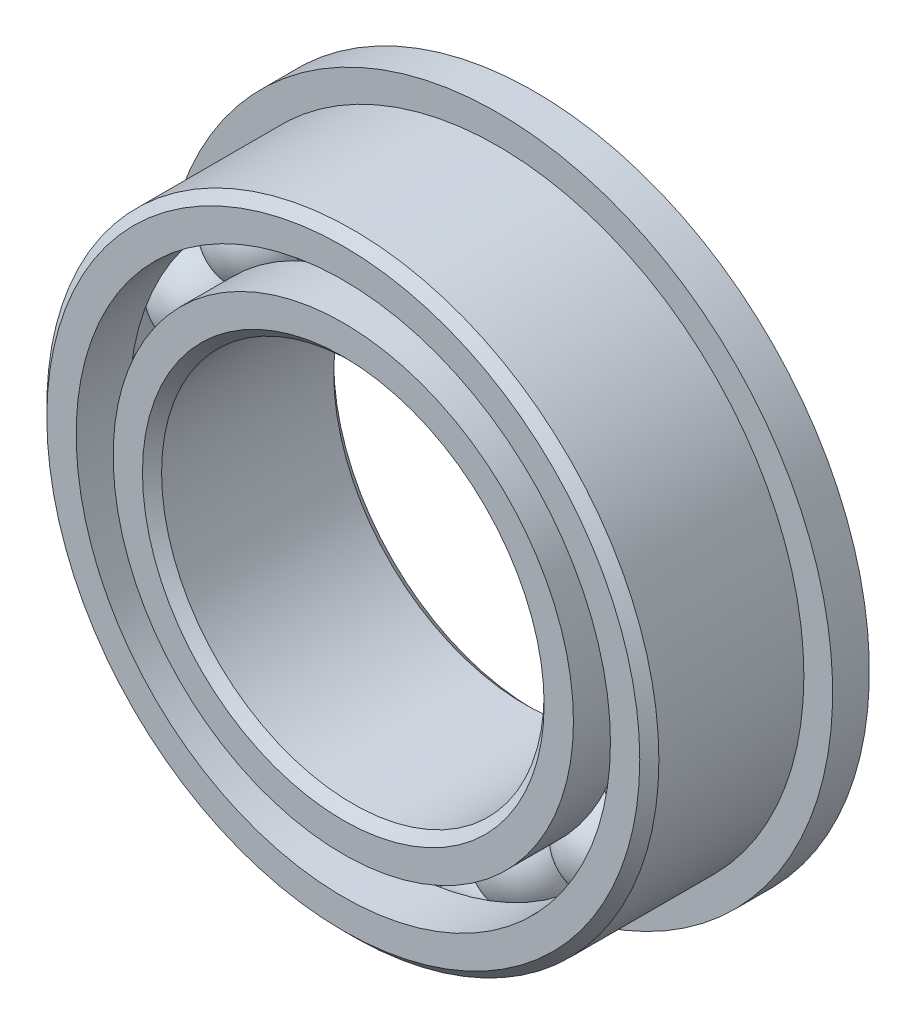
from build123d import *

# Parameters (mm, degrees)
CIRPATTERN1_COUNT = 16
SKETCH6_W         = 0.762
SKETCH6_H         = 1.403733791


with BuildPart() as part:
    # Sketch1 → Revolve1 (revolve)
    with BuildSketch(Plane(origin=(0, 0, 0), x_dir=(0, 0, -1), z_dir=(1, 0, 0))):
        with BuildLine():
            Line((1.7859375, 6.35), (-1.7859375, 6.35))
            Line((-1.7859375, 6.35), (-1.984375, 6.1515625))
            Line((-1.984375, 6.1515625), (-1.984375, 5.543166209))
            Line((-1.984375, 5.543166209), (-0.881944444, 5.543166209))
            ThreePointArc((-0.881944444, 5.543166209), (0, 6.121207467), (0.881944444, 5.543166209))
            Line((0.881944444, 5.543166209), (1.984375, 5.543166209))
            Line((1.984375, 5.543166209), (1.984375, 6.1515625))
            Line((1.984375, 6.1515625), (1.7859375, 6.35))
        make_face()
    revolve(axis=Axis((0, 0, 1.984375), (0, 0, -1)))

    # Sketch6 → Revolve6 (revolve)
    with BuildSketch(Plane(origin=(0, 0, 0), x_dir=(0, 0, -1), z_dir=(1, 0, 0))):
        with Locations((1.603375, 6.245033105)):
            Rectangle(SKETCH6_W, SKETCH6_H)
    revolve(axis=Axis((0, 0, -1.984375), (0, 0, 1)))


with BuildPart() as body_2:
    # Sketch3 → Revolve3 (revolve)
    with BuildSketch(Plane(origin=(0, 0, 0), x_dir=(0, 0, -1), z_dir=(1, 0, 0))):
        with BuildLine():
            Line((-1.984375, 4.775583791), (-0.881944444, 4.775583791))
            ThreePointArc((-0.881944444, 4.775583791), (0, 4.197542533), (0.881944444, 4.775583791))
            Line((0.881944444, 4.775583791), (1.984375, 4.775583791))
            Line((1.984375, 4.775583791), (1.984375, 4.1671875))
            Line((1.984375, 4.1671875), (1.7859375, 3.96875))
            Line((1.7859375, 3.96875), (-1.7859375, 3.96875))
            Line((-1.7859375, 3.96875), (-1.984375, 4.1671875))
            Line((-1.984375, 4.1671875), (-1.984375, 4.775583791))
        make_face()
    revolve(axis=Axis((0, 0, 1.984375), (0, 0, -1)))


with BuildPart() as body_3:
    # Sketch4 → Revolve4 (revolve)
    with BuildSketch(Plane(origin=(0, 0, 0), x_dir=(0, 0, -1), z_dir=(1, 0, 0))):
        with BuildLine():
            Line((-0.961832467, 5.159375), (0.961832467, 5.159375))
            ThreePointArc((0.961832467, 5.159375), (0, 6.121207467), (-0.961832467, 5.159375))
        make_face()
    revolve(axis=Axis((0, 5.159375, 0.961832467), (0, 0, -1)))


with BuildPart() as cirpattern1_1:
    # CirPattern1: pattern copy
    add(body_3.part.rotate(Axis((0, 0, -1.984375), (0, 0, 1)), 1 * 360 / CIRPATTERN1_COUNT))


with BuildPart() as cirpattern1_2:
    # CirPattern1: pattern copy
    add(body_3.part.rotate(Axis((0, 0, -1.984375), (0, 0, 1)), 2 * 360 / CIRPATTERN1_COUNT))


with BuildPart() as cirpattern1_3:
    # CirPattern1: pattern copy
    add(body_3.part.rotate(Axis((0, 0, -1.984375), (0, 0, 1)), 3 * 360 / CIRPATTERN1_COUNT))


with BuildPart() as cirpattern1_4:
    # CirPattern1: pattern copy
    add(body_3.part.rotate(Axis((0, 0, -1.984375), (0, 0, 1)), 4 * 360 / CIRPATTERN1_COUNT))


with BuildPart() as cirpattern1_5:
    # CirPattern1: pattern copy
    add(body_3.part.rotate(Axis((0, 0, -1.984375), (0, 0, 1)), 5 * 360 / CIRPATTERN1_COUNT))


with BuildPart() as cirpattern1_6:
    # CirPattern1: pattern copy
    add(body_3.part.rotate(Axis((0, 0, -1.984375), (0, 0, 1)), 6 * 360 / CIRPATTERN1_COUNT))


with BuildPart() as cirpattern1_7:
    # CirPattern1: pattern copy
    add(body_3.part.rotate(Axis((0, 0, -1.984375), (0, 0, 1)), 7 * 360 / CIRPATTERN1_COUNT))


with BuildPart() as cirpattern1_8:
    # CirPattern1: pattern copy
    add(body_3.part.rotate(Axis((0, 0, -1.984375), (0, 0, 1)), 8 * 360 / CIRPATTERN1_COUNT))


with BuildPart() as cirpattern1_9:
    # CirPattern1: pattern copy
    add(body_3.part.rotate(Axis((0, 0, -1.984375), (0, 0, 1)), 9 * 360 / CIRPATTERN1_COUNT))


with BuildPart() as cirpattern1_10:
    # CirPattern1: pattern copy
    add(body_3.part.rotate(Axis((0, 0, -1.984375), (0, 0, 1)), 10 * 360 / CIRPATTERN1_COUNT))


with BuildPart() as cirpattern1_11:
    # CirPattern1: pattern copy
    add(body_3.part.rotate(Axis((0, 0, -1.984375), (0, 0, 1)), 11 * 360 / CIRPATTERN1_COUNT))


with BuildPart() as cirpattern1_12:
    # CirPattern1: pattern copy
    add(body_3.part.rotate(Axis((0, 0, -1.984375), (0, 0, 1)), 12 * 360 / CIRPATTERN1_COUNT))


with BuildPart() as cirpattern1_13:
    # CirPattern1: pattern copy
    add(body_3.part.rotate(Axis((0, 0, -1.984375), (0, 0, 1)), 13 * 360 / CIRPATTERN1_COUNT))


with BuildPart() as cirpattern1_14:
    # CirPattern1: pattern copy
    add(body_3.part.rotate(Axis((0, 0, -1.984375), (0, 0, 1)), 14 * 360 / CIRPATTERN1_COUNT))


with BuildPart() as cirpattern1_15:
    # CirPattern1: pattern copy
    add(body_3.part.rotate(Axis((0, 0, -1.984375), (0, 0, 1)), 15 * 360 / CIRPATTERN1_COUNT))


solid = Compound([part.part, body_2.part, body_3.part, cirpattern1_1.part, cirpattern1_2.part, cirpattern1_3.part, cirpattern1_4.part, cirpattern1_5.part, cirpattern1_6.part, cirpattern1_7.part, cirpattern1_8.part, cirpattern1_9.part, cirpattern1_10.part, cirpattern1_11.part, cirpattern1_12.part, cirpattern1_13.part, cirpattern1_14.part, cirpattern1_15.part])
